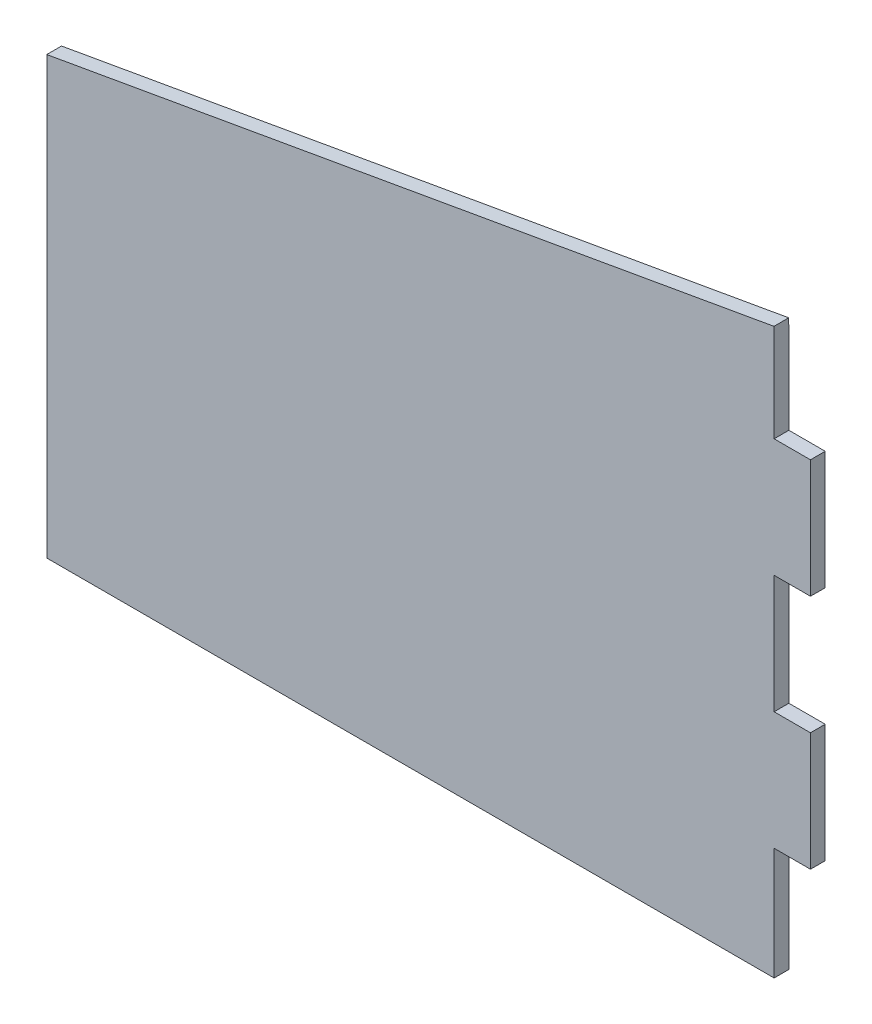
from build123d import *

# Parameters (mm, degrees)
BOSS_EXTRUDE1_START = 196.208778
BOSS_EXTRUDE1_DEPTH = 10.16


with BuildPart() as part:
    # Sketch1 → Boss-Extrude1 (new body)
    with BuildSketch(Plane.XY.offset(BOSS_EXTRUDE1_START)):
        Polygon((-0.102720764, -24.506851212), (-500.385059294, -112.720125467), (-500.385059294, -412.720125467), (0, -412.720125467), (0, -335.42775434), (25, -335.42775434), (25, -254.110815755), (0, -254.110815755), (0, -172.79387717), (25, -172.79387717), (25, -91.476938585), (0, -91.476938585), align=None)
    extrude(amount=BOSS_EXTRUDE1_DEPTH)


solid = part.part
